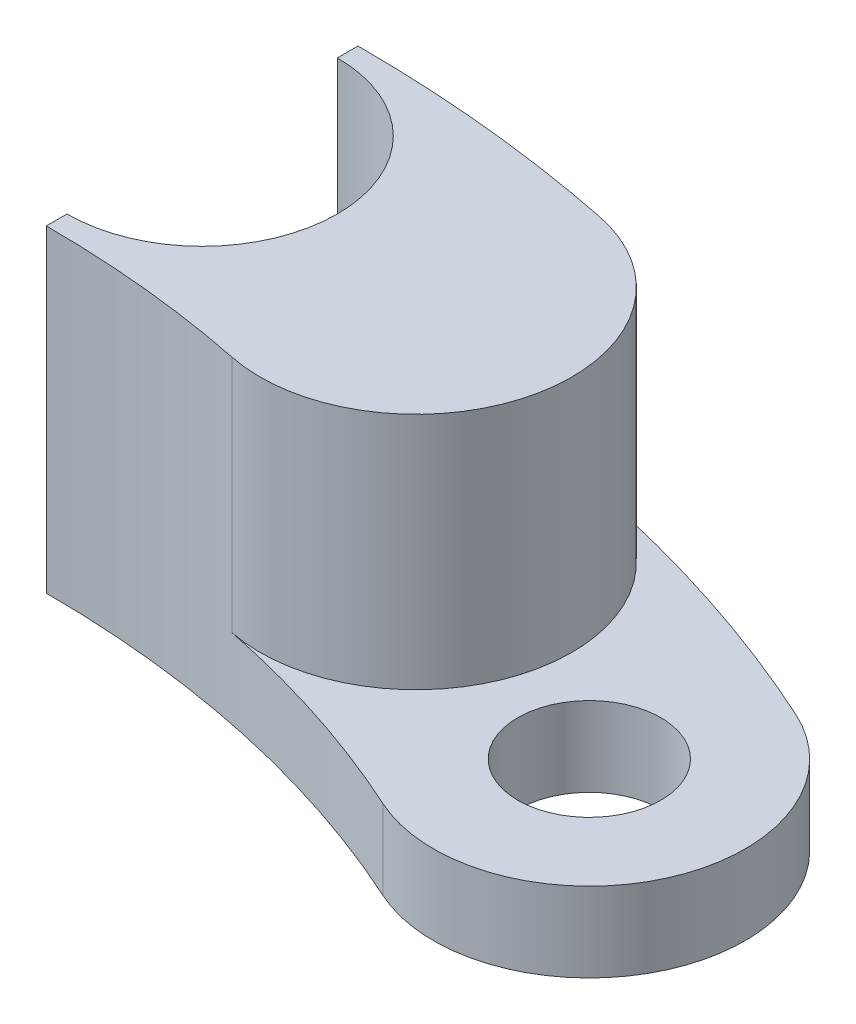
from build123d import *

# Parameters (mm, degrees)
SKETCH_1_R          = 4.9
SKETCH_1_R_2        = 2.25
EXTRUDE_1_DEPTH     = 10
CUT_EXTRUDE_START   = -7.5
SKETCH_2_R          = 2.25
CUT_EXTRUDE_1_DEPTH = 7.5


with BuildPart() as part:
    # ｽｹｯﾁ1 → ﾎﾞｽ - 押し出し1 (new body)
    # profile 1 of 3: a face of its own
    with BuildSketch(Plane(origin=(0, 0, 0), x_dir=(1, 0, 0), z_dir=(0, 1, 0))):
        with BuildLine():
            Line((8.453200419, 41.548807476), (6.499394662, 31.945545371))
            ThreePointArc((6.499394662, 31.945545371), (10.073954086, 31.004442409), (13.518999843, 29.66473737))
            ThreePointArc((13.518999843, 29.66473737), (11.092186389, 36.155544584), (17.582993695, 38.582357791))
            ThreePointArc((17.582993695, 38.582357791), (13.102320669, 40.324796256), (8.453200419, 41.548807476))
        make_face()
    # profile 2 of 3: a face of its own
    with BuildSketch(Plane(origin=(0, 0, 0), x_dir=(1, 0, 0), z_dir=(0, 1, 0))):
        with Locations((15.5509966, 34.123547658)):
            Circle(SKETCH_1_R)
        with Locations(Location((15.5509966, 34.123547658, 0), (0, 0, 270))):
            Circle(SKETCH_1_R_2, mode=Mode.SUBTRACT)
    # profile 3 of 3: a face of its own
    with BuildSketch(Plane(origin=(0, 0, 0), x_dir=(1, 0, 0), z_dir=(0, 1, 0))):
        with BuildLine():
            Line((0, 33.25), (0, 32.6))
            ThreePointArc((0, 32.6), (3.266130809, 32.435973695), (6.499394662, 31.945545371))
            Line((6.499394662, 31.945545371), (8.453200419, 41.548807476))
            ThreePointArc((8.453200419, 41.548807476), (4.247973812, 42.186665174), (0, 42.4))
            Line((0, 42.4), (0, 41.75))
            ThreePointArc((0, 41.75), (3.00520382, 40.50520382), (4.25, 37.5))
            ThreePointArc((4.25, 37.5), (3.00520382, 34.49479618), (0, 33.25))
        make_face()
    extrude(amount=EXTRUDE_1_DEPTH)

    # ｽｹｯﾁ2 → ｶｯﾄ - 押し出し1 (cut)
    with BuildSketch(Plane(origin=(0, 10, 0), x_dir=(1, 0, 0), z_dir=(0, 1, 0)).offset(CUT_EXTRUDE_START)):
        with BuildLine():
            ThreePointArc((13.518999843, 29.66473737), (20.00980681, 32.091550732), (17.582993695, 38.582357791))
            ThreePointArc((17.582993695, 38.582357791), (13.102320689, 40.32479625), (8.453200459, 41.548807468))
            ThreePointArc((8.453200459, 41.548807468), (12.277928583, 35.770273495), (6.499394603, 31.945545383))
            ThreePointArc((6.499394603, 31.945545383), (10.073954057, 31.004442418), (13.518999843, 29.66473737))
        make_face()
        with Locations(Location((15.5509966, 34.123547658, 0), (0, 0, 270))):
            Circle(SKETCH_2_R, mode=Mode.SUBTRACT)
    extrude(amount=CUT_EXTRUDE_1_DEPTH, mode=Mode.SUBTRACT)


solid = part.part
